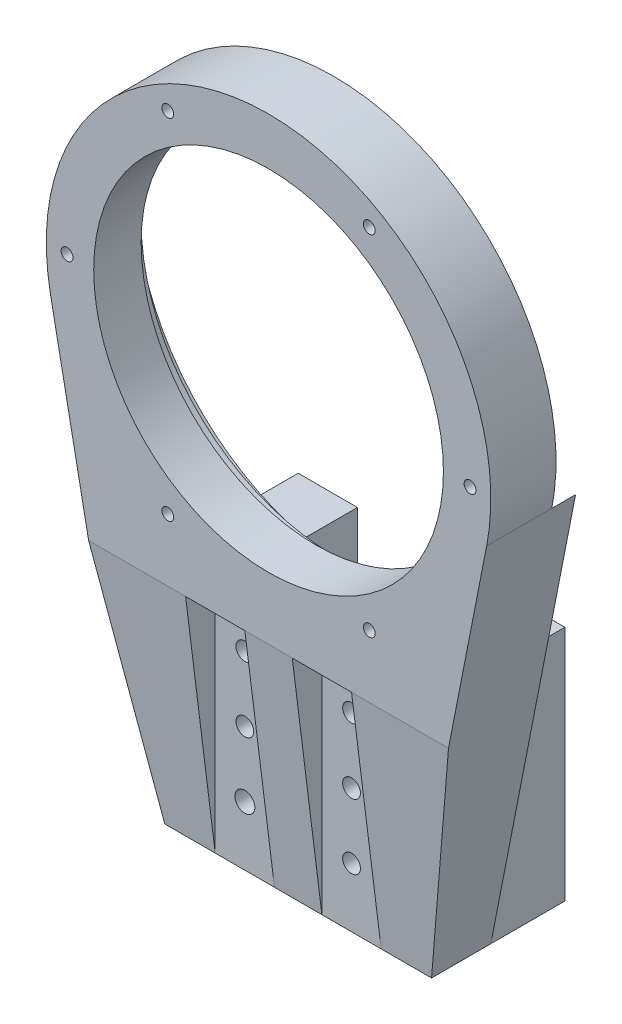
from build123d import *

# Parameters (mm, degrees)
SKETCH1_R               = 29.5
BOSS_EXTRUDE1_DEPTH     = 15
SKETCH2_R               = 32.5
SKETCH2_R_2             = 27.5
CUT_EXTRUDE1_DEPTH      = 7
SKETCH9_R               = 1
CUT_EXTRUDE5_DEPTH      = 15
SKETCH10_R              = 37.5
CUT_EXTRUDE6_DEPTH      = 4
CUT_EXTRUDE7_DEPTH      = 35
CUT_EXTRUDE7_DEPTH_BACK = 35
SKETCH12_W              = 10
SKETCH12_H              = 40
CUT_EXTRUDE8_DEPTH      = 5
SKETCH13_R              = 1.5
SKETCH13_R_2            = 1.68215716
CUT_EXTRUDE9_DEPTH      = 10
SKETCH14_W              = 10
SKETCH14_H              = 40
BOSS_EXTRUDE2_DEPTH     = 12.5


with BuildPart() as part:
    # Sketch1 → Boss-Extrude1 (new body)
    with BuildSketch(Plane.XY):
        with BuildLine():
            Line((-36.796608813, -7.229078771), (-22.5, -80))
            Line((-22.5, -80), (22.5, -80))
            Line((22.5, -80), (36.796608813, -7.229078771))
            ThreePointArc((36.796608813, -7.229078771), (0, 37.5), (-36.796608813, -7.229078771))
        make_face()
        Circle(SKETCH1_R, mode=Mode.SUBTRACT)
    extrude(amount=BOSS_EXTRUDE1_DEPTH)

    # Sketch2 → Cut-Extrude1 (cut)
    with BuildSketch(Plane(origin=(0, 0, 0), x_dir=(-1, 0, 0), z_dir=(0, 0, -1))):
        Circle(SKETCH2_R)
        Circle(SKETCH2_R_2, mode=Mode.SUBTRACT)
    extrude(amount=-CUT_EXTRUDE1_DEPTH, mode=Mode.SUBTRACT)

    # Sketch9 → Cut-Extrude5 (cut)
    with BuildSketch(Plane.XY.offset(15)):
        with Locations((17, 29.444863729)):
            Circle(SKETCH9_R)
        with Locations((34, 0)):
            Circle(SKETCH9_R)
        with Locations((17, -29.444863729)):
            Circle(SKETCH9_R)
        with Locations((-17, -29.444863729)):
            Circle(SKETCH9_R)
        with Locations((-34, 0)):
            Circle(SKETCH9_R)
        with Locations((-17, 29.444863729)):
            Circle(SKETCH9_R)
    extrude(amount=-CUT_EXTRUDE5_DEPTH, mode=Mode.SUBTRACT)

    # Sketch10 → Cut-Extrude6 (cut)
    with BuildSketch(Plane(origin=(0, 0, 0), x_dir=(-1, 0, 0), z_dir=(0, 0, -1))):
        Circle(SKETCH10_R)
    extrude(amount=-CUT_EXTRUDE6_DEPTH, mode=Mode.SUBTRACT)

    # Sketch11 → Cut-Extrude7 (cut, two sides: drawn at the far end of the back side and taken through both)
    with BuildSketch(Plane(origin=(0, 0, 0), x_dir=(0, 0, -1), z_dir=(1, 0, 0)).offset(-CUT_EXTRUDE7_DEPTH_BACK)):
        Polygon((-15, -80), (-15, -40), (-10, -80), align=None)
    extrude(amount=CUT_EXTRUDE7_DEPTH + CUT_EXTRUDE7_DEPTH_BACK, mode=Mode.SUBTRACT)

    # Sketch12 → Cut-Extrude8 (cut)
    with BuildSketch(Plane.XY.offset(15)):
        with Locations((-9, -60)):
            Rectangle(SKETCH12_W, SKETCH12_H)
        with Locations((9, -60)):
            Rectangle(SKETCH12_W, SKETCH12_H)
    extrude(amount=-CUT_EXTRUDE8_DEPTH, mode=Mode.SUBTRACT)

    # Sketch13 → Cut-Extrude9 (cut)
    with BuildSketch(Plane.XY.offset(10)):
        with Locations((-9, -48)):
            Circle(SKETCH13_R)
        with Locations((-9, -59)):
            Circle(SKETCH13_R)
        with Locations((-9, -70)):
            Circle(SKETCH13_R_2)
        with Locations((9, -70)):
            Circle(SKETCH13_R)
        with Locations((9, -59)):
            Circle(SKETCH13_R)
        with Locations((9, -48)):
            Circle(SKETCH13_R)
    extrude(amount=-CUT_EXTRUDE9_DEPTH, mode=Mode.SUBTRACT)

    # Sketch14 → Boss-Extrude2 (add)
    with BuildSketch(Plane(origin=(0, 0, 0), x_dir=(-1, 0, 0), z_dir=(0, 0, -1))):
        with Locations((-17.5, -60)):
            Rectangle(SKETCH14_W, SKETCH14_H)
        with Locations((17.5, -60)):
            Rectangle(SKETCH14_W, SKETCH14_H)
    extrude(amount=BOSS_EXTRUDE2_DEPTH)


solid = part.part
